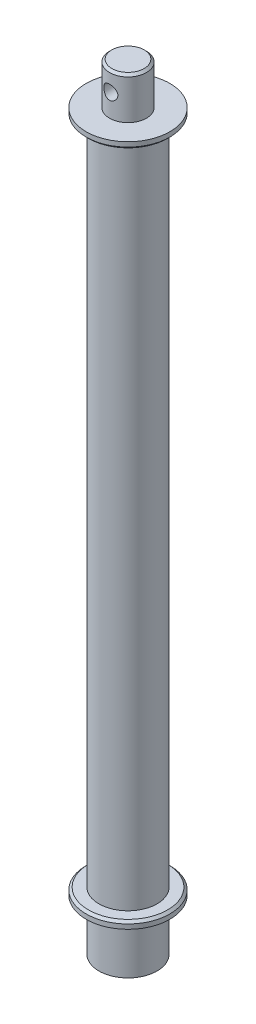
from build123d import *

# Parameters (mm, degrees)
SKETCH_1_R               = 7.95
EXTRUDE_1_DEPTH          = 18
CUT_EXTRUDE_2_DEPTH      = 22.22274723
CUT_EXTRUDE_2_DEPTH_BACK = 22.22274723
SKETCH_9_R               = 3
CHAMFER_2_SIZE           = 1
SKETCH_4_R               = 18
EXTRUDE_2_DEPTH          = 3
CHAMFER_1_SIZE           = 1
SKETCH_5_R               = 12.5
EXTRUDE_3_DEPTH          = 287.21
SKETCH_11_R              = 18
EXTRUDE_4_DEPTH          = 3
CHAMFER_3_SIZE           = 1
SKETCH_12_R              = 12.5
EXTRUDE_5_DEPTH          = 22


with BuildPart() as part:
    # 草图1 → 凸台-拉伸1 (new body)
    with BuildSketch(Plane(origin=(0, 0, 0), x_dir=(1, 0, 0), z_dir=(0, 1, 0))):
        with Locations(Location((0, 0, 0), (0, 0, 270))):
            Circle(SKETCH_1_R)
    extrude(amount=EXTRUDE_1_DEPTH)

    # 草图9 → 切除-拉伸2 (cut, two sides: drawn at the far end of the back side and taken through both)
    with BuildSketch(Plane.XY.offset(-CUT_EXTRUDE_2_DEPTH_BACK)):
        with Locations(Location((0, 9.7, 0), (0, 0, 89.999999999))):
            Circle(SKETCH_9_R)
    extrude(amount=CUT_EXTRUDE_2_DEPTH + CUT_EXTRUDE_2_DEPTH_BACK, mode=Mode.SUBTRACT)

    # 倒角2
    chamfer_2_edges = [part.edges().sort_by_distance(p)[0] for p in [
        (0, 18, -7.95),
    ]]
    chamfer(chamfer_2_edges, length=CHAMFER_2_SIZE)

    # 草图4 → 凸台-拉伸2 (add)
    with BuildSketch(Plane(origin=(0, 0, 0), x_dir=(1, 0, 0), z_dir=(0, 1, 0))):
        with Locations(Location((0, 0, 0), (0, 0, 270))):
            Circle(SKETCH_4_R)
    extrude(amount=-EXTRUDE_2_DEPTH)

    # 倒角1
    chamfer_1_edges = [part.edges().sort_by_distance(p)[0] for p in [
        (0, -3, -18),
    ]]
    chamfer(chamfer_1_edges, length=CHAMFER_1_SIZE)

    # 草图5 → 凸台-拉伸3 (add)
    with BuildSketch(Plane(origin=(0, -3, 0), x_dir=(-1, 0, 0), z_dir=(0, -1, 0))):
        with Locations(Location((0, 0, 0), (0, 0, 90))):
            Circle(SKETCH_5_R)
    extrude(amount=EXTRUDE_3_DEPTH)

    # 草图11 → 凸台-拉伸4 (add)
    with BuildSketch(Plane(origin=(0, -290.21, 0), x_dir=(-1, 0, 0), z_dir=(0, -1, 0))):
        with Locations(Location((0, 0, 0), (0, 0, 270))):
            Circle(SKETCH_11_R)
    extrude(amount=EXTRUDE_4_DEPTH)

    # 倒角3
    chamfer_3_edges = [part.edges().sort_by_distance(p)[0] for p in [
        (0, -290.21, -18),
    ]]
    chamfer(chamfer_3_edges, length=CHAMFER_3_SIZE)

    # 草图12 → 凸台-拉伸5 (add)
    with BuildSketch(Plane(origin=(0, -293.21, 0), x_dir=(-1, 0, 0), z_dir=(0, -1, 0))):
        with Locations(Location((0, 0, 0), (0, 0, 90))):
            Circle(SKETCH_12_R)
        with BuildLine():
            ThreePointArc((1.320081673, 7.281303755), (1.178664492, 7.305528729), (1.036804222, 7.32700737))
            add(Edge.make_bspline(
                [(1.036804222, 7.32700737), (0.98134965, 7.270157618), (0.925664274, 7.213171767), (0.822185541, 7.094937546), (0.774343886, 7.0337151), (0.63529092, 6.847559045), (0.548900941, 6.720025238), (0.477457544, 6.587144437)],
                knots=[0, 0, 0, 0, 0.25, 0.25, 0.5, 0.5, 1, 1, 1, 1], degree=3))
            add(Edge.make_bspline(
                [(0.477457544, 6.587144437), (0.46567048, 6.560002351), (0.446966493, 6.534634967), (0.392581446, 6.494187019), (0.35492303, 6.479375674), (0.274403836, 6.478342584), (0.234194599, 6.492926686), (0.17747799, 6.534562396), (0.158353176, 6.560913911), (0.146609232, 6.588640193)],
                knots=[0, 0, 0, 0, 0.25, 0.25, 0.5, 0.5, 0.75, 0.75, 1, 1, 1, 1], degree=3))
            add(Edge.make_bspline(
                [(0.146609232, 6.588640193), (0.08740641, 6.729534896), (0.022470705, 6.869008307), (-0.095794129, 7.071358543), (-0.138881023, 7.137641916), (-0.232486034, 7.266772188), (-0.282985736, 7.329709483), (-0.333258043, 7.392492075)],
                knots=[0, 0, 0, 0, 0.5, 0.5, 0.75, 0.75, 1, 1, 1, 1], degree=3))
            ThreePointArc((-0.333258043, 7.392492075), (-0.476520163, 7.384641395), (-0.619603147, 7.374014642))
            add(Edge.make_bspline(
                [(-0.619603147, 7.374014642), (-0.661016757, 7.306295373), (-0.702626317, 7.238396062), (-0.777131854, 7.100013493), (-0.81002747, 7.029653932), (-0.904545175, 6.817549796), (-0.96175064, 6.674495088), (-1.00180826, 6.529141787)],
                knots=[0, 0, 0, 0, 0.25, 0.25, 0.5, 0.5, 1, 1, 1, 1], degree=3))
            add(Edge.make_bspline(
                [(-1.00180826, 6.529141787), (-1.007260291, 6.500056407), (-1.019851277, 6.471161347), (-1.063877396, 6.419622784), (-1.097300476, 6.396802915), (-1.175575057, 6.377883569), (-1.218016451, 6.383157985), (-1.2825686, 6.411128867), (-1.307075953, 6.432562593), (-1.324694352, 6.456979366)],
                knots=[0, 0, 0, 0, 0.25, 0.25, 0.5, 0.5, 0.75, 0.75, 1, 1, 1, 1], degree=3))
            add(Edge.make_bspline(
                [(-1.324694352, 6.456979366), (-1.413614576, 6.580958145), (-1.507332752, 6.702515875), (-1.667328954, 6.873226276), (-1.724044414, 6.928139193), (-1.843879739, 7.033004611), (-1.907009883, 7.083047863), (-1.969886809, 7.132989974)],
                knots=[0, 0, 0, 0, 0.5, 0.5, 0.75, 0.75, 1, 1, 1, 1], degree=3))
            ThreePointArc((-1.969886809, 7.132989974), (-2.107810108, 7.093457306), (-2.244941028, 7.051258028))
            add(Edge.make_bspline(
                [(-2.244941028, 7.051258028), (-2.270240635, 6.97611209), (-2.29569085, 6.900747155), (-2.33740091, 6.749436272), (-2.353691734, 6.673613582), (-2.399065608, 6.44603228), (-2.42437654, 6.293898001), (-2.431078979, 6.143425776)],
                knots=[0, 0, 0, 0, 0.25, 0.25, 0.5, 0.5, 1, 1, 1, 1], degree=3))
            add(Edge.make_bspline(
                [(-2.431078979, 6.143425776), (-2.429922181, 6.113855694), (-2.43576799, 6.082881939), (-2.467225285, 6.0228357), (-2.494736028, 5.993149765), (-2.566842091, 5.957290187), (-2.609389834, 5.952991684), (-2.678542059, 5.965898104), (-2.70720286, 5.981340256), (-2.729811993, 6.001223703)],
                knots=[0, 0, 0, 0, 0.25, 0.25, 0.5, 0.5, 0.75, 0.75, 1, 1, 1, 1], degree=3))
            add(Edge.make_bspline(
                [(-2.729811993, 6.001223703), (-2.843877093, 6.102118361), (-2.961914778, 6.199724831), (-3.155568154, 6.330271891), (-3.22298186, 6.371086663), (-3.36290588, 6.446499746), (-3.435454942, 6.481176753), (-3.507737225, 6.51580997)],
                knots=[0, 0, 0, 0, 0.5, 0.5, 0.75, 0.75, 1, 1, 1, 1], degree=3))
            ThreePointArc((-3.507737225, 6.51580997), (-3.633405652, 6.446577648), (-3.757708191, 6.374921894))
            add(Edge.make_bspline(
                [(-3.757708191, 6.374921894), (-3.765661336, 6.296145746), (-3.773711675, 6.217123105), (-3.780628656, 6.060577536), (-3.779555087, 5.98316972), (-3.773567955, 5.751425564), (-3.76559783, 5.597330834), (-3.73868501, 5.449337815)],
                knots=[0, 0, 0, 0, 0.25, 0.25, 0.5, 0.5, 1, 1, 1, 1], degree=3))
            add(Edge.make_bspline(
                [(-3.73868501, 5.449337815), (-3.730977124, 5.420766049), (-3.729784019, 5.389267097), (-3.747092838, 5.323723878), (-3.767310283, 5.288659423), (-3.829632003, 5.237655307), (-3.870154864, 5.223999521), (-3.940441779, 5.221196026), (-3.971819075, 5.229873104), (-3.998285225, 5.244226695)],
                knots=[0, 0, 0, 0, 0.25, 0.25, 0.5, 0.5, 0.75, 0.75, 1, 1, 1, 1], degree=3))
            add(Edge.make_bspline(
                [(-3.998285225, 5.244226695), (-4.131679461, 5.317066829), (-4.268286418, 5.385729002), (-4.485811664, 5.469600321), (-4.560473941, 5.49433348), (-4.71337102, 5.536635681), (-4.791666926, 5.5542605), (-4.869695049, 5.571900047)],
                knots=[0, 0, 0, 0, 0.5, 0.5, 0.75, 0.75, 1, 1, 1, 1], degree=3))
            ThreePointArc((-4.869695049, 5.571900047), (-4.976807066, 5.476439668), (-5.082048175, 5.378920556))
            add(Edge.make_bspline(
                [(-5.082048175, 5.378920556), (-5.072307153, 5.300480381), (-5.062604808, 5.221779379), (-5.034518789, 5.067912661), (-5.016219275, 4.992847823), (-4.959223266, 4.768468173), (-4.918131698, 4.619753183), (-4.859057526, 4.481682374)],
                knots=[0, 0, 0, 0, 0.25, 0.25, 0.5, 0.5, 1, 1, 1, 1], degree=3))
            add(Edge.make_bspline(
                [(-4.859057526, 4.481682374), (-4.84518497, 4.455541927), (-4.837012485, 4.425097777), (-4.839303134, 4.35734495), (-4.85121199, 4.318660125), (-4.900623152, 4.255067306), (-4.937090851, 4.232738081), (-5.004990321, 4.214365565), (-5.037511241, 4.215842975), (-5.066507504, 4.223947336)],
                knots=[0, 0, 0, 0, 0.25, 0.25, 0.5, 0.5, 0.75, 0.75, 1, 1, 1, 1], degree=3))
            add(Edge.make_bspline(
                [(-5.066507504, 4.223947336), (-5.212479986, 4.265197318), (-5.360842681, 4.301259016), (-5.591236124, 4.334292187), (-5.669365778, 4.341792837), (-5.82752242, 4.349018187), (-5.907622431, 4.348769055), (-5.987466029, 4.348591789)],
                knots=[0, 0, 0, 0, 0.5, 0.5, 0.75, 0.75, 1, 1, 1, 1], degree=3))
            ThreePointArc((-5.987466029, 4.348591789), (-6.070650592, 4.231690135), (-6.151553043, 4.113197681))
            add(Edge.make_bspline(
                [(-6.151553043, 4.113197681), (-6.124665565, 4.039025234), (-6.097756483, 3.964591683), (-6.036232894, 3.821126102), (-6.001721667, 3.752176471), (-5.89662458, 3.54632475), (-5.824172681, 3.410224987), (-5.736016371, 3.288981736)],
                knots=[0, 0, 0, 0, 0.25, 0.25, 0.5, 0.5, 1, 1, 1, 1], degree=3))
            add(Edge.make_bspline(
                [(-5.736016371, 3.288981736), (-5.716674869, 3.266583661), (-5.701932862, 3.238721432), (-5.689089612, 3.172157886), (-5.692091568, 3.131793217), (-5.726112746, 3.058799878), (-5.756697383, 3.028915331), (-5.818806504, 2.995894044), (-5.850840964, 2.990097794), (-5.880913704, 2.99154669)],
                knots=[0, 0, 0, 0, 0.25, 0.25, 0.5, 0.5, 0.75, 0.75, 1, 1, 1, 1], degree=3))
            add(Edge.make_bspline(
                [(-5.880913704, 2.99154669), (-6.032125452, 2.999266228), (-6.184669857, 3.000659406), (-6.416269574, 2.981259188), (-6.493951949, 2.971250179), (-6.649452268, 2.943197824), (-6.727343, 2.925149799), (-6.805000462, 2.907226981)],
                knots=[0, 0, 0, 0, 0.5, 0.5, 0.75, 0.75, 1, 1, 1, 1], degree=3))
            ThreePointArc((-6.805000462, 2.907226981), (-6.860086348, 2.774745989), (-6.912593354, 2.641221899))
            add(Edge.make_bspline(
                [(-6.912593354, 2.641221899), (-6.86996668, 2.575015519), (-6.827259822, 2.508561801), (-6.735534222, 2.382638229), (-6.68663265, 2.323229472), (-6.538755144, 2.146143868), (-6.438293854, 2.029438921), (-6.325587168, 1.931042891)],
                knots=[0, 0, 0, 0, 0.25, 0.25, 0.5, 0.5, 1, 1, 1, 1], degree=3))
            add(Edge.make_bspline(
                [(-6.325587168, 1.931042891), (-6.301746827, 1.91351047), (-6.281174901, 1.889627675), (-6.253842013, 1.827592925), (-6.247786067, 1.787573767), (-6.264709489, 1.708840724), (-6.287877015, 1.67289766), (-6.341082224, 1.626881406), (-6.371024468, 1.614101802), (-6.400666098, 1.608822474)],
                knots=[0, 0, 0, 0, 0.25, 0.25, 0.5, 0.5, 0.75, 0.75, 1, 1, 1, 1], degree=3))
            add(Edge.make_bspline(
                [(-6.400666098, 1.608822474), (-6.549559075, 1.582743795), (-6.698324928, 1.549172857), (-6.919406346, 1.478394293), (-6.992789957, 1.451467308), (-7.137909138, 1.389684274), (-7.209706129, 1.354796727), (-7.281303755, 1.320081673)],
                knots=[0, 0, 0, 0, 0.5, 0.5, 0.75, 0.75, 1, 1, 1, 1], degree=3))
            ThreePointArc((-7.281303755, 1.320081673), (-7.305528729, 1.178664493), (-7.32700737, 1.036804223))
            add(Edge.make_bspline(
                [(-7.32700737, 1.036804223), (-7.270829339, 0.981845361), (-7.21451758, 0.926666067), (-7.097308167, 0.824494804), (-7.036536641, 0.777540611), (-6.853346185, 0.638018122), (-6.729723915, 0.546669005), (-6.598206373, 0.475958565)],
                knots=[0, 0, 0, 0, 0.25, 0.25, 0.5, 0.5, 1, 1, 1, 1], degree=3))
            add(Edge.make_bspline(
                [(-6.598206373, 0.475958565), (-6.571624678, 0.463639432), (-6.546877049, 0.444637459), (-6.507538993, 0.390166285), (-6.493277367, 0.35281192), (-6.492280063, 0.273518396), (-6.506240234, 0.233785027), (-6.546781435, 0.176863082), (-6.572509338, 0.157415149), (-6.59970213, 0.145110252)],
                knots=[0, 0, 0, 0, 0.25, 0.25, 0.5, 0.5, 0.75, 0.75, 1, 1, 1, 1], degree=3))
            add(Edge.make_bspline(
                [(-6.59970213, 0.145110252), (-6.738870057, 0.086632861), (-6.875941633, 0.019665553), (-7.075315702, -0.09884181), (-7.140797267, -0.141273025), (-7.268373925, -0.233592416), (-7.330511037, -0.283531059), (-7.392492075, -0.333258043)],
                knots=[0, 0, 0, 0, 0.5, 0.5, 0.75, 0.75, 1, 1, 1, 1], degree=3))
            ThreePointArc((-7.392492075, -0.333258043), (-7.384641395, -0.476520163), (-7.374014642, -0.619603147))
            add(Edge.make_bspline(
                [(-7.374014642, -0.619603147), (-7.307137234, -0.660609026), (-7.240080527, -0.701797019), (-7.103332751, -0.775228732), (-7.033771876, -0.807459702), (-6.824506903, -0.902506121), (-6.683886014, -0.96371013), (-6.540203723, -1.00330724)],
                knots=[0, 0, 0, 0, 0.25, 0.25, 0.5, 0.5, 1, 1, 1, 1], degree=3))
            add(Edge.make_bspline(
                [(-6.540203723, -1.00330724), (-6.511347255, -1.00910232), (-6.482739972, -1.021921218), (-6.431772235, -1.066116528), (-6.409274207, -1.099443431), (-6.390513761, -1.177071883), (-6.395515726, -1.219205986), (-6.422889996, -1.283735745), (-6.443966352, -1.308345255), (-6.468041302, -1.326193332)],
                knots=[0, 0, 0, 0, 0.25, 0.25, 0.5, 0.5, 0.75, 0.75, 1, 1, 1, 1], degree=3))
            add(Edge.make_bspline(
                [(-6.468041302, -1.326193332), (-6.590585732, -1.414084809), (-6.708551773, -1.511042288), (-6.876132514, -1.671225086), (-6.9305228, -1.727007263), (-7.034294678, -1.845195621), (-7.083694901, -1.907661656), (-7.132989974, -1.969886809)],
                knots=[0, 0, 0, 0, 0.5, 0.5, 0.75, 0.75, 1, 1, 1, 1], degree=3))
            ThreePointArc((-7.132989974, -1.969886809), (-7.093457306, -2.107810108), (-7.051258028, -2.244941028))
            add(Edge.make_bspline(
                [(-7.051258028, -2.244941028), (-6.977050627, -2.269992263), (-6.902628685, -2.295178253), (-6.753208404, -2.336331226), (-6.678338983, -2.352311874), (-6.453543439, -2.398199602), (-6.303121798, -2.425957395), (-6.154487712, -2.432577958)],
                knots=[0, 0, 0, 0, 0.25, 0.25, 0.5, 0.5, 1, 1, 1, 1], degree=3))
            add(Edge.make_bspline(
                [(-6.154487712, -2.432577958), (-6.124965795, -2.431542676), (-6.094067853, -2.437477983), (-6.034193537, -2.469017995), (-6.004615511, -2.49651281), (-5.968842443, -2.56841858), (-5.964471907, -2.610863097), (-5.977193326, -2.679979868), (-5.992521252, -2.70865298), (-6.012285639, -2.731310973)],
                knots=[0, 0, 0, 0, 0.25, 0.25, 0.5, 0.5, 0.75, 0.75, 1, 1, 1, 1], degree=3))
            add(Edge.make_bspline(
                [(-6.012285639, -2.731310973), (-6.112142188, -2.844202248), (-6.204549346, -2.966054877), (-6.331861183, -3.159767754), (-6.372526395, -3.226120105), (-6.4474172, -3.364273666), (-6.48163794, -3.436134768), (-6.51580997, -3.507737224)],
                knots=[0, 0, 0, 0, 0.5, 0.5, 0.75, 0.75, 1, 1, 1, 1], degree=3))
            ThreePointArc((-6.51580997, -3.507737224), (-6.446577648, -3.633405652), (-6.374921894, -3.757708191))
            add(Edge.make_bspline(
                [(-6.374921894, -3.757708191), (-6.297102394, -3.765598577), (-6.21904506, -3.773570126), (-6.064397237, -3.7805044), (-5.987928246, -3.779507791), (-5.758921713, -3.774016921), (-5.606565563, -3.76676453), (-5.460399751, -3.740183989)],
                knots=[0, 0, 0, 0, 0.25, 0.25, 0.5, 0.5, 1, 1, 1, 1], degree=3))
            add(Edge.make_bspline(
                [(-5.460399751, -3.740183989), (-5.431823439, -3.732418074), (-5.40030852, -3.731177545), (-5.334720481, -3.748415503), (-5.299616831, -3.768608497), (-5.248540205, -3.830981635), (-5.234880471, -3.871572018), (-5.232141539, -3.941927929), (-5.24087366, -3.973321938), (-5.255288632, -3.999784205)],
                knots=[0, 0, 0, 0, 0.25, 0.25, 0.5, 0.5, 0.75, 0.75, 1, 1, 1, 1], degree=3))
            add(Edge.make_bspline(
                [(-5.255288632, -3.999784205), (-5.327511438, -4.132047911), (-5.389270515, -4.272286497), (-5.469870449, -4.489707851), (-5.494845986, -4.563356811), (-5.537194431, -4.714621993), (-5.554541842, -4.792290433), (-5.571900047, -4.869695049)],
                knots=[0, 0, 0, 0, 0.5, 0.5, 0.75, 0.75, 1, 1, 1, 1], degree=3))
            ThreePointArc((-5.571900047, -4.869695049), (-5.476439668, -4.976807066), (-5.378920556, -5.082048175))
            add(Edge.make_bspline(
                [(-5.378920556, -5.082048175), (-5.301372786, -5.072419594), (-5.223576685, -5.062815367), (-5.071366047, -5.03526514), (-4.997058759, -5.017385834), (-4.775370132, -4.96086732), (-4.629176425, -4.918929555), (-4.49274431, -4.860556505)],
                knots=[0, 0, 0, 0, 0.25, 0.25, 0.5, 0.5, 1, 1, 1, 1], degree=3))
            add(Edge.make_bspline(
                [(-4.49274431, -4.860556505), (-4.46662118, -4.846540536), (-4.436157617, -4.838243813), (-4.368313369, -4.840349291), (-4.329535439, -4.852192893), (-4.265745411, -4.901715291), (-4.243394366, -4.938335211), (-4.225157199, -5.00641079), (-4.226757265, -5.038991519), (-4.235009272, -5.068006484)],
                knots=[0, 0, 0, 0, 0.25, 0.25, 0.5, 0.5, 0.75, 0.75, 1, 1, 1, 1], degree=3))
            add(Edge.make_bspline(
                [(-4.235009272, -5.068006484), (-4.276003088, -5.213071968), (-4.303709721, -5.364153748), (-4.333505381, -5.594282073), (-4.341580003, -5.671613239), (-4.349304529, -5.82851082), (-4.34891285, -5.908116317), (-4.348591789, -5.987466029)],
                knots=[0, 0, 0, 0, 0.5, 0.5, 0.75, 0.75, 1, 1, 1, 1], degree=3))
            ThreePointArc((-4.348591789, -5.987466029), (-4.231690135, -6.070650591), (-4.113197681, -6.151553043))
            add(Edge.make_bspline(
                [(-4.113197681, -6.151553043), (-4.039783559, -6.124908026), (-3.966123504, -6.098230328), (-3.823872387, -6.037603171), (-3.755367487, -6.003743254), (-3.552160679, -5.899099438), (-3.419978779, -5.824720505), (-3.300043672, -5.737515351)],
                knots=[0, 0, 0, 0, 0.25, 0.25, 0.5, 0.5, 1, 1, 1, 1], degree=3))
            add(Edge.make_bspline(
                [(-3.300043672, -5.737515351), (-3.277689094, -5.71805789), (-3.249837572, -5.703209451), (-3.183244497, -5.690191205), (-3.142821584, -5.693114769), (-3.069641507, -5.727178304), (-3.039697101, -5.757887731), (-3.006744703, -5.820180345), (-3.001039094, -5.852293203), (-3.002608626, -5.882412684)],
                knots=[0, 0, 0, 0, 0.25, 0.25, 0.5, 0.5, 0.75, 0.75, 1, 1, 1, 1], degree=3))
            add(Edge.make_bspline(
                [(-3.002608626, -5.882412684), (-3.010300366, -6.033077262), (-3.002439505, -6.186882044), (-2.979889363, -6.418088259), (-2.970658465, -6.495310423), (-2.943353058, -6.650084899), (-2.92522611, -6.727659924), (-2.907226981, -6.805000461)],
                knots=[0, 0, 0, 0, 0.5, 0.5, 0.75, 0.75, 1, 1, 1, 1], degree=3))
            ThreePointArc((-2.907226981, -6.805000461), (-2.774745989, -6.860086348), (-2.641221899, -6.912593354))
            add(Edge.make_bspline(
                [(-2.641221899, -6.912593354), (-2.575596368, -6.870268027), (-2.509739634, -6.827855556), (-2.384476826, -6.737158649), (-2.325130051, -6.688981028), (-2.150649193, -6.541521223), (-2.039600761, -6.438761828), (-1.942104828, -6.327086147)],
                knots=[0, 0, 0, 0, 0.25, 0.25, 0.5, 0.5, 1, 1, 1, 1], degree=3))
            add(Edge.make_bspline(
                [(-1.942104828, -6.327086147), (-1.924576727, -6.303251681), (-1.900704329, -6.282688722), (-1.83871447, -6.255358909), (-1.798727924, -6.249288233), (-1.720006887, -6.266163113), (-1.684018358, -6.289323559), (-1.637952408, -6.342555239), (-1.625165542, -6.37251332), (-1.61988441, -6.402165077)],
                knots=[0, 0, 0, 0, 0.25, 0.25, 0.5, 0.5, 0.75, 0.75, 1, 1, 1, 1], degree=3))
            add(Edge.make_bspline(
                [(-1.61988441, -6.402165077), (-1.593827277, -6.550935046), (-1.550844136, -6.699256637), (-1.477031366, -6.919865932), (-1.450918131, -6.993182562), (-1.389876038, -7.138164228), (-1.354889165, -7.20983428), (-1.320081673, -7.281303755)],
                knots=[0, 0, 0, 0, 0.5, 0.5, 0.75, 0.75, 1, 1, 1, 1], degree=3))
            ThreePointArc((-1.320081673, -7.281303755), (-1.178664493, -7.305528729), (-1.036804223, -7.32700737))
            add(Edge.make_bspline(
                [(-1.036804223, -7.32700737), (-0.982256494, -7.271122895), (-0.927503814, -7.21509805), (-0.825564244, -7.098956367), (-0.778328663, -7.038868824), (-0.641325169, -6.855985118), (-0.557241733, -6.730312994), (-0.487020501, -6.599705353)],
                knots=[0, 0, 0, 0, 0.25, 0.25, 0.5, 0.5, 1, 1, 1, 1], degree=3))
            add(Edge.make_bspline(
                [(-0.487020501, -6.599705353), (-0.475080621, -6.572732965), (-0.456296872, -6.547556103), (-0.40192786, -6.507444512), (-0.364389199, -6.492787345), (-0.28425499, -6.491722616), (-0.244139505, -6.506109386), (-0.187317374, -6.547434913), (-0.168084032, -6.573620987), (-0.156172188, -6.601201109)],
                knots=[0, 0, 0, 0, 0.25, 0.25, 0.5, 0.5, 0.75, 0.75, 1, 1, 1, 1], degree=3))
            add(Edge.make_bspline(
                [(-0.156172188, -6.601201109), (-0.097577071, -6.740649557), (-0.021812834, -6.875679488), (0.099610678, -7.074555161), (0.141367622, -7.140338523), (0.233204146, -7.268305364), (0.283342296, -7.330476435), (0.333258043, -7.392492075)],
                knots=[0, 0, 0, 0, 0.5, 0.5, 0.75, 0.75, 1, 1, 1, 1], degree=3))
            ThreePointArc((0.333258043, -7.392492075), (0.476520163, -7.384641395), (0.619603147, -7.374014642))
            add(Edge.make_bspline(
                [(0.619603147, -7.374014642), (0.660370815, -7.307311833), (0.70130806, -7.240430228), (0.775084866, -7.104238162), (0.807926708, -7.035045768), (0.90038307, -6.826095977), (0.952825914, -6.684740119), (0.992245304, -6.541702703)],
                knots=[0, 0, 0, 0, 0.25, 0.25, 0.5, 0.5, 1, 1, 1, 1], degree=3))
            add(Edge.make_bspline(
                [(0.992245304, -6.541702703), (0.997695812, -6.512625446), (1.010280614, -6.483744594), (1.054262508, -6.4322312), (1.087645051, -6.409412425), (1.165883134, -6.390449487), (1.208367326, -6.395694154), (1.272983501, -6.42366762), (1.297506148, -6.445114017), (1.315131395, -6.469540282)],
                knots=[0, 0, 0, 0, 0.25, 0.25, 0.5, 0.5, 0.75, 0.75, 1, 1, 1, 1], degree=3))
            add(Edge.make_bspline(
                [(1.315131395, -6.469540282), (1.403440776, -6.59266738), (1.507935266, -6.70743162), (1.670932876, -6.874532702), (1.726326574, -6.929495134), (1.844490868, -7.034020791), (1.907315988, -7.083555964), (1.969886809, -7.132989973)],
                knots=[0, 0, 0, 0, 0.5, 0.5, 0.75, 0.75, 1, 1, 1, 1], degree=3))
            ThreePointArc((1.969886809, -7.132989973), (2.107810108, -7.093457306), (2.244941028, -7.051258028))
            add(Edge.make_bspline(
                [(2.244941028, -7.051258028), (2.269850953, -6.97706445), (2.294886899, -6.902658683), (2.336639301, -6.753282033), (2.353386826, -6.67842288), (2.396638684, -6.453899015), (2.414906713, -6.304368104), (2.421516022, -6.155986692)],
                knots=[0, 0, 0, 0, 0.25, 0.25, 0.5, 0.5, 1, 1, 1, 1], degree=3))
            add(Edge.make_bspline(
                [(2.421516022, -6.155986692), (2.420359754, -6.126430154), (2.42606912, -6.095760585), (2.457666063, -6.035331432), (2.485143191, -6.005707166), (2.557440534, -5.969789244), (2.599530867, -5.965522609), (2.669026949, -5.978442784), (2.697639291, -5.993900633), (2.720249036, -6.013784618)],
                knots=[0, 0, 0, 0, 0.25, 0.25, 0.5, 0.5, 0.75, 0.75, 1, 1, 1, 1], degree=3))
            add(Edge.make_bspline(
                [(2.720249036, -6.013784618), (2.833958276, -6.114364687), (2.961706079, -6.203082965), (3.15816033, -6.32996766), (3.224498155, -6.371323427), (3.363196322, -6.447096548), (3.435603284, -6.481473532), (3.507737224, -6.51580997)],
                knots=[0, 0, 0, 0, 0.5, 0.5, 0.75, 0.75, 1, 1, 1, 1], degree=3))
            ThreePointArc((3.507737224, -6.51580997), (3.633405652, -6.446577647), (3.757708191, -6.374921894))
            add(Edge.make_bspline(
                [(3.757708191, -6.374921894), (3.765474723, -6.296929182), (3.773317866, -6.218701023), (3.780860722, -6.06352427), (3.780615646, -5.986675002), (3.772409596, -5.757927451), (3.755734546, -5.608240252), (3.729122053, -5.461898731)],
                knots=[0, 0, 0, 0, 0.25, 0.25, 0.5, 0.5, 1, 1, 1, 1], degree=3))
            add(Edge.make_bspline(
                [(3.729122053, -5.461898731), (3.721416487, -5.433335563), (3.720234329, -5.401798135), (3.737502503, -5.336368126), (3.757655938, -5.301330536), (3.819971289, -5.25026093), (3.860512934, -5.236574856), (3.930842792, -5.233747128), (3.962245647, -5.24242834), (3.988722268, -5.256787611)],
                knots=[0, 0, 0, 0, 0.25, 0.25, 0.5, 0.5, 0.75, 0.75, 1, 1, 1, 1], degree=3))
            add(Edge.make_bspline(
                [(3.988722268, -5.256787611), (4.122223543, -5.329686193), (4.266671225, -5.388035486), (4.486793268, -5.468284149), (4.560814599, -5.493894215), (4.713190584, -5.536993747), (4.791581441, -5.554435329), (4.869695049, -5.571900047)],
                knots=[0, 0, 0, 0, 0.5, 0.5, 0.75, 0.75, 1, 1, 1, 1], degree=3))
            ThreePointArc((4.869695049, -5.571900047), (4.976807066, -5.476439667), (5.082048175, -5.378920556))
            add(Edge.make_bspline(
                [(5.082048175, -5.378920556), (5.072230202, -5.301023499), (5.062435761, -5.222878746), (5.03525604, -5.069618206), (5.017944366, -4.99458565), (4.958615656, -4.773190077), (4.908104482, -4.631229012), (4.849494569, -4.494243289)],
                knots=[0, 0, 0, 0, 0.25, 0.25, 0.5, 0.5, 1, 1, 1, 1], degree=3))
            add(Edge.make_bspline(
                [(4.849494569, -4.494243289), (4.835616179, -4.468091848), (4.827427908, -4.437775543), (4.829768153, -4.369602472), (4.841358937, -4.331530263), (4.891563584, -4.267044762), (4.927578899, -4.245279052), (4.995435029, -4.226930556), (5.027959783, -4.228407104), (5.056944547, -4.236508251)],
                knots=[0, 0, 0, 0, 0.25, 0.25, 0.5, 0.5, 0.75, 0.75, 1, 1, 1, 1], degree=3))
            add(Edge.make_bspline(
                [(5.056944547, -4.236508251), (5.203602863, -4.277952183), (5.357503844, -4.303228143), (5.590327447, -4.332763287), (5.668353865, -4.341254566), (5.826814133, -4.349365459), (5.907273349, -4.34893547), (5.987466029, -4.348591789)],
                knots=[0, 0, 0, 0, 0.5, 0.5, 0.75, 0.75, 1, 1, 1, 1], degree=3))
            ThreePointArc((5.987466029, -4.348591789), (6.070650591, -4.231690135), (6.151553043, -4.113197681))
            add(Edge.make_bspline(
                [(6.151553043, -4.113197681), (6.124583133, -4.039304216), (6.09758228, -3.965162295), (6.036886712, -3.821494047), (6.003278493, -3.752033399), (5.895740814, -3.549204004), (5.814243398, -3.422282087), (5.726453415, -3.301542651)],
                knots=[0, 0, 0, 0, 0.25, 0.25, 0.5, 0.5, 1, 1, 1, 1], degree=3))
            add(Edge.make_bspline(
                [(5.726453415, -3.301542651), (5.70711549, -3.279148719), (5.692380095, -3.251285781), (5.679535313, -3.184812978), (5.682557947, -3.144179132), (5.716699765, -3.071151665), (5.746867425, -3.041630156), (5.809415924, -3.008351378), (5.841300643, -3.0026598), (5.871350747, -3.004107606)],
                knots=[0, 0, 0, 0, 0.25, 0.25, 0.5, 0.5, 0.75, 0.75, 1, 1, 1, 1], degree=3))
            add(Edge.make_bspline(
                [(5.871350747, -3.004107606), (6.023828681, -3.011891921), (6.179631422, -3.003072451), (6.413565407, -2.980358974), (6.491678393, -2.971209579), (6.648263692, -2.94376439), (6.726752761, -2.925423003), (6.805000461, -2.907226981)],
                knots=[0, 0, 0, 0, 0.5, 0.5, 0.75, 0.75, 1, 1, 1, 1], degree=3))
            ThreePointArc((6.805000461, -2.907226981), (6.860086348, -2.774745989), (6.912593354, -2.641221899))
            add(Edge.make_bspline(
                [(6.912593354, -2.641221899), (6.86976468, -2.575058863), (6.826851514, -2.508658174), (6.735532407, -2.381837093), (6.687221533, -2.321464741), (6.536822945, -2.147482722), (6.42870485, -2.041977096), (6.316024211, -1.943603807)],
                knots=[0, 0, 0, 0, 0.25, 0.25, 0.5, 0.5, 1, 1, 1, 1], degree=3))
            add(Edge.make_bspline(
                [(6.316024211, -1.943603807), (6.292202798, -1.926085306), (6.271651915, -1.902231085), (6.244322401, -1.840300294), (6.238219617, -1.80007818), (6.25517879, -1.721324441), (6.278134546, -1.685622461), (6.331648585, -1.639321858), (6.36147363, -1.626660559), (6.391103141, -1.621383389)],
                knots=[0, 0, 0, 0, 0.25, 0.25, 0.5, 0.5, 0.75, 0.75, 1, 1, 1, 1], degree=3))
            add(Edge.make_bspline(
                [(6.391103141, -1.621383389), (6.541729214, -1.595001158), (6.69194757, -1.552723515), (6.915357219, -1.478839564), (6.989595583, -1.452422514), (7.136382962, -1.390656815), (7.208944937, -1.355270783), (7.281303755, -1.320081673)],
                knots=[0, 0, 0, 0, 0.5, 0.5, 0.75, 0.75, 1, 1, 1, 1], degree=3))
            ThreePointArc((7.281303755, -1.320081673), (7.305528729, -1.178664493), (7.32700737, -1.036804222))
            add(Edge.make_bspline(
                [(7.32700737, -1.036804222), (7.270516282, -0.981524202), (7.21384699, -0.926100448), (7.096137231, -0.823440055), (7.035290397, -0.775846781), (6.912053503, -0.683229244), (6.849785584, -0.638082087), (6.721178434, -0.557651364), (6.655248604, -0.522126639), (6.588643417, -0.488519481)],
                knots=[0, 0, 0, 0, 0.25, 0.25, 0.5, 0.5, 0.75, 0.75, 1, 1, 1, 1], degree=3))
            add(Edge.make_bspline(
                [(6.588643417, -0.488519481), (6.561514446, -0.476738112), (6.536164364, -0.45804855), (6.49573421, -0.403728944), (6.48088063, -0.36632396), (6.479835772, -0.285141211), (6.494187284, -0.245600895), (6.536230184, -0.188290374), (6.56242334, -0.169410687), (6.590139173, -0.157671168)],
                knots=[0, 0, 0, 0, 0.25, 0.25, 0.5, 0.5, 0.75, 0.75, 1, 1, 1, 1], degree=3))
            add(Edge.make_bspline(
                [(6.590139173, -0.157671168), (6.731618184, -0.099892576), (6.869008547, -0.025561734), (7.070502771, 0.096970963), (7.137119201, 0.13919962), (7.266757098, 0.231958076), (7.329709777, 0.282708602), (7.392492075, 0.333258043)],
                knots=[0, 0, 0, 0, 0.5, 0.5, 0.75, 0.75, 1, 1, 1, 1], degree=3))
            ThreePointArc((7.392492075, 0.333258043), (7.384641395, 0.476520163), (7.374014642, 0.619603147))
            add(Edge.make_bspline(
                [(7.374014642, 0.619603147), (7.306468657, 0.660973003), (7.238741537, 0.702534707), (7.100647139, 0.776668242), (7.030396293, 0.809267586), (6.818939408, 0.904598163), (6.676384081, 0.963426857), (6.530640767, 0.990746324)],
                knots=[0, 0, 0, 0, 0.25, 0.25, 0.5, 0.5, 1, 1, 1, 1], degree=3))
            add(Edge.make_bspline(
                [(6.530640767, 0.990746324), (6.501535921, 0.996202004), (6.472626587, 1.00880555), (6.421078037, 1.052865444), (6.39825721, 1.086312078), (6.379372331, 1.164667049), (6.384468217, 1.206461111), (6.412724379, 1.27178706), (6.434058855, 1.296012056), (6.458478345, 1.313632416)],
                knots=[0, 0, 0, 0, 0.25, 0.25, 0.5, 0.5, 0.75, 0.75, 1, 1, 1, 1], degree=3))
            add(Edge.make_bspline(
                [(6.458478345, 1.313632416), (6.583020117, 1.40295643), (6.701516531, 1.504128765), (6.871668457, 1.667094161), (6.927135264, 1.723414573), (7.032747431, 1.843193706), (7.082917283, 1.906673569), (7.132989973, 1.969886809)],
                knots=[0, 0, 0, 0, 0.5, 0.5, 0.75, 0.75, 1, 1, 1, 1], degree=3))
            ThreePointArc((7.132989973, 1.969886809), (7.093457306, 2.107810108), (7.051258028, 2.244941028))
            add(Edge.make_bspline(
                [(7.051258028, 2.244941028), (6.97612348, 2.270098673), (6.900772378, 2.29539767), (6.749499885, 2.337738569), (6.67368407, 2.354788174), (6.446404297, 2.397255153), (6.295181008, 2.413324223), (6.144924755, 2.420017043)],
                knots=[0, 0, 0, 0, 0.25, 0.25, 0.5, 0.5, 1, 1, 1, 1], degree=3))
            add(Edge.make_bspline(
                [(6.144924755, 2.420017043), (6.115353347, 2.418860193), (6.084383669, 2.42470716), (6.02435316, 2.45615112), (5.994671316, 2.483644944), (5.958795374, 2.555751448), (5.954486422, 2.598308902), (5.967402609, 2.667505999), (5.982835709, 2.696136913), (6.002722682, 2.718750057)],
                knots=[0, 0, 0, 0, 0.25, 0.25, 0.5, 0.5, 0.75, 0.75, 1, 1, 1, 1], degree=3))
            add(Edge.make_bspline(
                [(6.002722682, 2.718750057), (6.104321516, 2.833611046), (6.19832592, 2.957582623), (6.328409079, 3.154026669), (6.369904802, 3.221408161), (6.446190692, 3.361852276), (6.481018111, 3.434935332), (6.51580997, 3.507737224)],
                knots=[0, 0, 0, 0, 0.5, 0.5, 0.75, 0.75, 1, 1, 1, 1], degree=3))
            ThreePointArc((6.51580997, 3.507737224), (6.446577647, 3.633405652), (6.374921894, 3.757708191))
            add(Edge.make_bspline(
                [(6.374921894, 3.757708191), (6.295972158, 3.765535964), (6.216778543, 3.773455768), (6.059694966, 3.781012338), (5.981908222, 3.780679226), (5.750513805, 3.771707425), (5.599018386, 3.754570186), (5.450836795, 3.727623073)],
                knots=[0, 0, 0, 0, 0.25, 0.25, 0.5, 0.5, 1, 1, 1, 1], degree=3))
            add(Edge.make_bspline(
                [(5.450836795, 3.727623073), (5.42226972, 3.719916453), (5.39078149, 3.718724219), (5.325269072, 3.736012497), (5.290217988, 3.756203502), (5.239194926, 3.818492501), (5.225503193, 3.858932101), (5.222689615, 3.929558189), (5.231367665, 3.960748993), (5.245725675, 3.987223289)],
                knots=[0, 0, 0, 0, 0.25, 0.25, 0.5, 0.5, 0.75, 0.75, 1, 1, 1, 1], degree=3))
            add(Edge.make_bspline(
                [(5.245725675, 3.987223289), (5.319227865, 4.121829968), (5.384454861, 4.262762424), (5.468028642, 4.482955262), (5.493400134, 4.557968839), (5.536438913, 4.711961859), (5.554155881, 4.790969055), (5.571900047, 4.869695049)],
                knots=[0, 0, 0, 0, 0.5, 0.5, 0.75, 0.75, 1, 1, 1, 1], degree=3))
            ThreePointArc((5.571900047, 4.869695049), (5.476439667, 4.976807066), (5.378920556, 5.082048175))
            add(Edge.make_bspline(
                [(5.378920556, 5.082048175), (5.300132951, 5.072116586), (5.22108549, 5.0622223), (5.06615884, 5.034531593), (4.990375087, 5.016789562), (4.766411501, 4.956777557), (4.621793654, 4.907301441), (4.483181353, 4.84799559)],
                knots=[0, 0, 0, 0, 0.25, 0.25, 0.5, 0.5, 1, 1, 1, 1], degree=3))
            add(Edge.make_bspline(
                [(4.483181353, 4.84799559), (4.45706623, 4.834136473), (4.42666048, 4.825969411), (4.359003124, 4.828214868), (4.320370277, 4.840061994), (4.256778247, 4.889321007), (4.234369448, 4.925753844), (4.215881496, 4.993653272), (4.217336372, 5.026429332), (4.225446315, 5.055445568)],
                knots=[0, 0, 0, 0, 0.25, 0.25, 0.5, 0.5, 0.75, 0.75, 1, 1, 1, 1], degree=3))
            add(Edge.make_bspline(
                [(4.225446315, 5.055445568), (4.267140483, 5.202989399), (4.300618625, 5.354293147), (4.333553351, 5.587316853), (4.341486789, 5.666126358), (4.349076939, 5.825839963), (4.348790503, 5.906786554), (4.348591789, 5.987466029)],
                knots=[0, 0, 0, 0, 0.5, 0.5, 0.75, 0.75, 1, 1, 1, 1], degree=3))
            ThreePointArc((4.348591789, 5.987466029), (4.231690135, 6.070650591), (4.113197681, 6.151553043))
            add(Edge.make_bspline(
                [(4.113197681, 6.151553043), (4.038549304, 6.124340884), (3.963637642, 6.097108475), (3.818748997, 6.035532034), (3.748852826, 6.001266617), (3.543478441, 5.89316687), (3.412498514, 5.81367392), (3.290480715, 5.724954435)],
                knots=[0, 0, 0, 0, 0.25, 0.25, 0.5, 0.5, 1, 1, 1, 1], degree=3))
            add(Edge.make_bspline(
                [(3.290480715, 5.724954435), (3.268086187, 5.705615996), (3.240231877, 5.690878194), (3.17369717, 5.6780304), (3.133350795, 5.681018279), (3.060357418, 5.715007581), (3.030443298, 5.745594641), (2.99739495, 5.807727242), (2.991596458, 5.83977248), (2.99304567, 5.869851768)],
                knots=[0, 0, 0, 0, 0.25, 0.25, 0.5, 0.5, 0.75, 0.75, 1, 1, 1, 1], degree=3))
            add(Edge.make_bspline(
                [(2.99304567, 5.869851768), (3.000857332, 6.022865371), (3.001047923, 6.177466621), (2.981732435, 6.411751372), (2.971826862, 6.490321319), (2.943605745, 6.647633442), (2.925344907, 6.726436986), (2.907226981, 6.805000461)],
                knots=[0, 0, 0, 0, 0.5, 0.5, 0.75, 0.75, 1, 1, 1, 1], degree=3))
            ThreePointArc((2.907226981, 6.805000461), (2.774745989, 6.860086348), (2.641221899, 6.912593354))
            add(Edge.make_bspline(
                [(2.641221899, 6.912593354), (2.574481741, 6.869465326), (2.50748801, 6.826259583), (2.380009301, 6.73391874), (2.31958338, 6.68488365), (2.143015656, 6.534048344), (2.031780288, 6.428196822), (1.932541871, 6.314525231)],
                knots=[0, 0, 0, 0, 0.25, 0.25, 0.5, 0.5, 1, 1, 1, 1], degree=3))
            add(Edge.make_bspline(
                [(1.932541871, 6.314525231), (1.915011308, 6.290687418), (1.891133092, 6.270119453), (1.829117947, 6.242787901), (1.789112839, 6.236725426), (1.71038429, 6.253628066), (1.674421506, 6.276792877), (1.628384194, 6.330009338), (1.615601548, 6.359958227), (1.610321453, 6.389604161)],
                knots=[0, 0, 0, 0, 0.25, 0.25, 0.5, 0.5, 0.75, 0.75, 1, 1, 1, 1], degree=3))
            add(Edge.make_bspline(
                [(1.610321453, 6.389604161), (1.583917407, 6.540354789), (1.550790442, 6.690979575), (1.480219433, 6.914873993), (1.453007242, 6.9891893), (1.390466234, 7.136118811), (1.355178878, 7.208812208), (1.320081673, 7.281303755)],
                knots=[0, 0, 0, 0, 0.5, 0.5, 0.75, 0.75, 1, 1, 1, 1], degree=3))
        make_face(mode=Mode.SUBTRACT)
    extrude(amount=EXTRUDE_5_DEPTH)


solid = part.part
